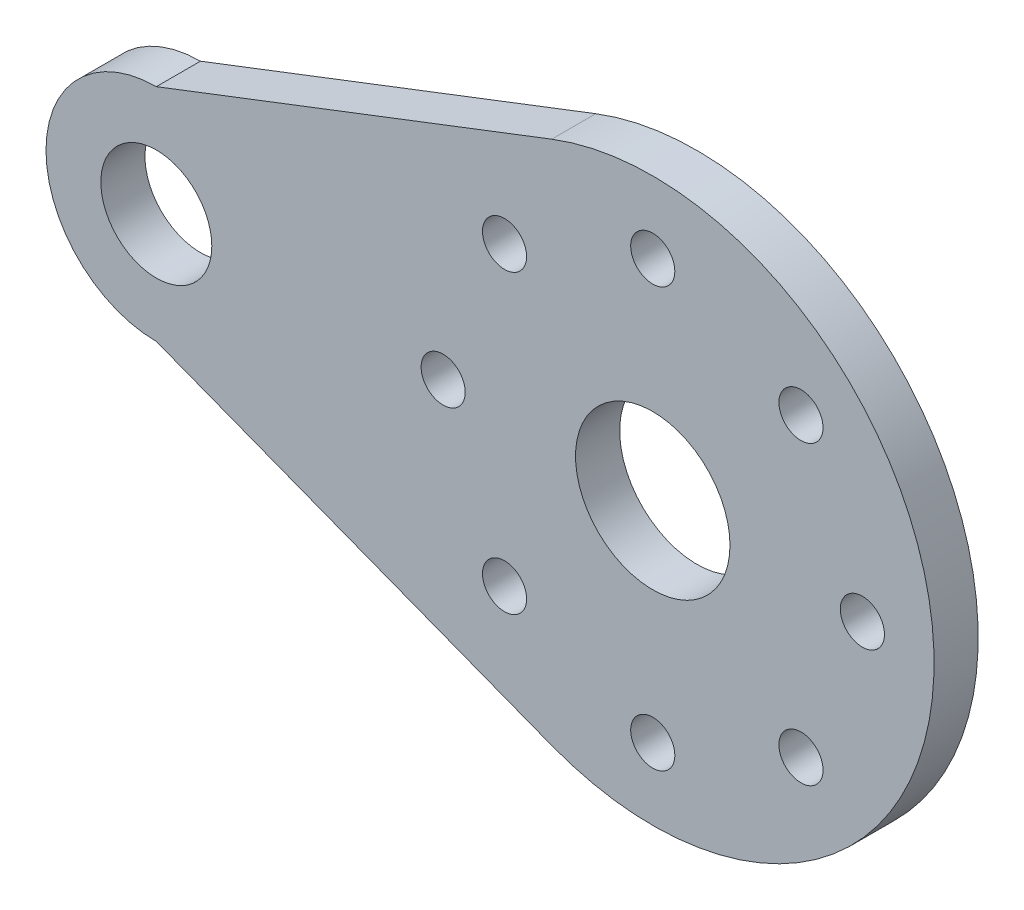
from build123d import *

# Parameters (mm, degrees)
SKETCH_1_R      = 7
SKETCH_1_R_2    = 2
SKETCH_1_R_3    = 5.03
EXTRUDE_1_DEPTH = 4


with BuildPart() as part:
    # 草图1 → 凸台-拉伸1 (new body)
    with BuildSketch(Plane.XY):
        with BuildLine():
            Line((95.464772606, -26.638271318), (131.303069471, -40.435607212))
            ThreePointArc((131.303069471, -40.435607212), (165.964772606, -16.638271318), (131.303069471, 7.159064577))
            Line((131.303069471, 7.159064577), (95.464772606, -6.638271318))
            ThreePointArc((95.464772606, -6.638271318), (85.464772606, -16.638271318), (95.464772606, -26.638271318))
        make_face()
        with Locations((140.464772606, -16.638271318)):
            Circle(SKETCH_1_R, mode=Mode.SUBTRACT)
        with Locations((140.464772606, -35.638271318)):
            Circle(SKETCH_1_R_2, mode=Mode.SUBTRACT)
        with Locations((127.029743763, -30.07330016)):
            Circle(SKETCH_1_R_2, mode=Mode.SUBTRACT)
        with Locations((121.464772606, -16.638271318)):
            Circle(SKETCH_1_R_2, mode=Mode.SUBTRACT)
        with Locations((127.029743763, -3.203242475)):
            Circle(SKETCH_1_R_2, mode=Mode.SUBTRACT)
        with Locations((140.464772606, 2.361728682)):
            Circle(SKETCH_1_R_2, mode=Mode.SUBTRACT)
        with Locations((153.899801448, -3.203242475)):
            Circle(SKETCH_1_R_2, mode=Mode.SUBTRACT)
        with Locations((159.464772606, -16.638271318)):
            Circle(SKETCH_1_R_2, mode=Mode.SUBTRACT)
        with Locations((153.899801448, -30.07330016)):
            Circle(SKETCH_1_R_2, mode=Mode.SUBTRACT)
        with Locations((95.464772606, -16.638271318)):
            Circle(SKETCH_1_R_3, mode=Mode.SUBTRACT)
    extrude(amount=EXTRUDE_1_DEPTH)


solid = part.part
